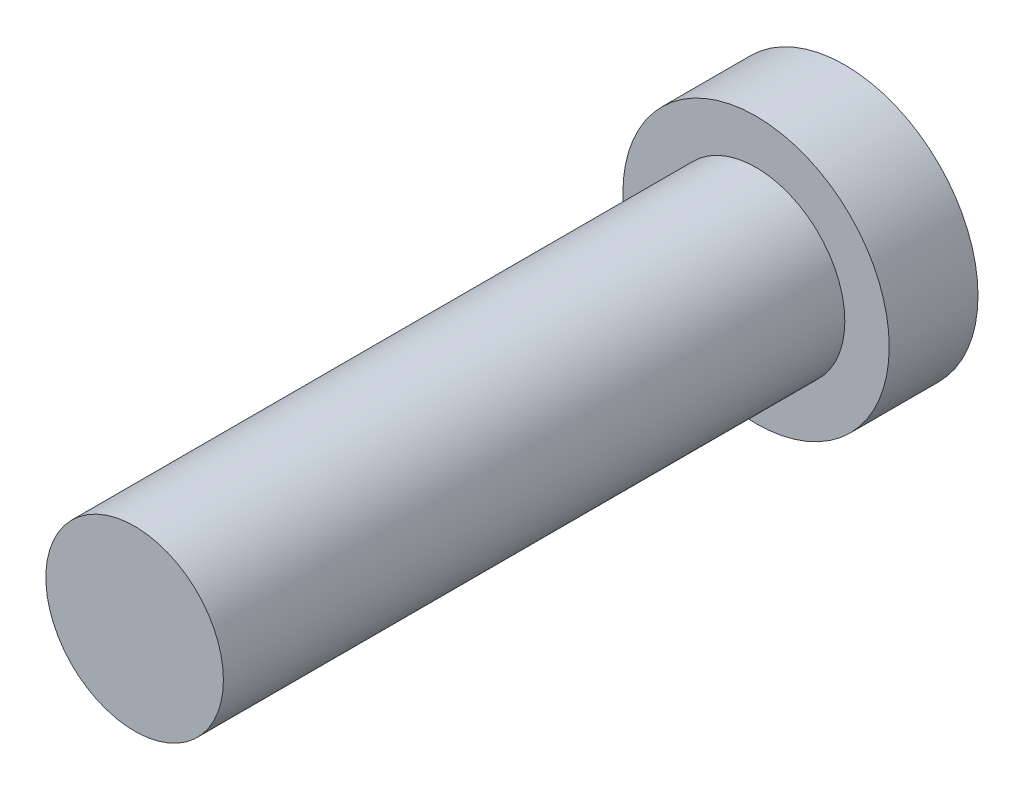
from build123d import *

# Parameters (mm, degrees)
SKETCH1_R           = 5
BOSS_EXTRUDE1_DEPTH = 35
SKETCH2_R           = 7.5
BOSS_EXTRUDE2_DEPTH = 5


with BuildPart() as part:
    # Sketch1 → Boss-Extrude1 (new body)
    with BuildSketch(Plane.XY):
        Circle(SKETCH1_R)
    extrude(amount=BOSS_EXTRUDE1_DEPTH)

    # Sketch2 → Boss-Extrude2 (add)
    with BuildSketch(Plane(origin=(0, 0, 0), x_dir=(-1, 0, 0), z_dir=(0, 0, -1))):
        Circle(SKETCH2_R)
    extrude(amount=BOSS_EXTRUDE2_DEPTH)


solid = part.part
